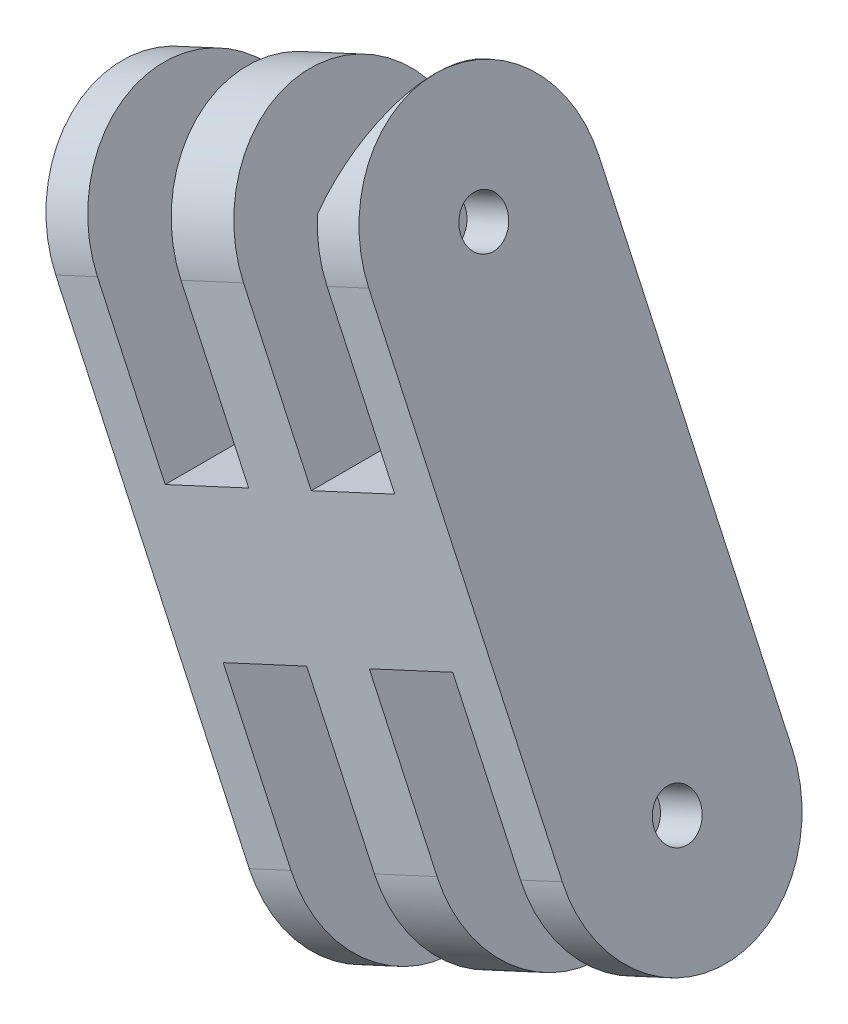
from build123d import *

# Parameters (mm, degrees)
BOSS_EXTRU_1_DEPTH      = 10
ESQUISSE2_R             = 1
ENL_V_MAT_EXTRU_1_DEPTH = 15


with BuildPart() as part:
    # Esquisse1 → Boss.-Extru.1 (new body)
    with BuildSketch(Plane.XY):
        Polygon((-110.738106784, 134.804121916), (-112.552630047, 133.962988556), (-99.935629642, 106.745139618), (-98.12110638, 107.586272978), (-103.167906542, 118.473412553), (-99.538860017, 120.155679274), (-94.492059855, 109.268539699), (-91.770274961, 110.530239739), (-96.817075123, 121.417379314), (-93.188028598, 123.099646035), (-88.141228436, 112.21250646), (-86.326705174, 113.05363982), (-98.943705578, 140.271488758), (-99.586991765, 136.903720479), (-95.711428679, 128.543215823), (-99.340475204, 126.860949102), (-104.387275366, 137.748088677), (-107.109060259, 136.486388637), (-102.062260098, 125.599249062), (-105.691306623, 123.916982341), align=None)
    extrude(amount=BOSS_EXTRU_1_DEPTH)

    # Esquisse2 → Enlèv. mat.-Extru.1 (cut)
    with BuildSketch(Plane(origin=(-27.920353757, -12.942650812, 0), x_dir=(0, 0, -1), z_dir=(0.9072616312569988, 0.42056668014583565, 0))):
        with Locations(Location((-5, 163.875365486, 0), (0, 0, 90))):
            Circle(ESQUISSE2_R)
        with Locations(Location((-5, 143.875365486, 0), (0, 0, 90))):
            Circle(ESQUISSE2_R)
        with BuildLine():
            Line((0, 138.875365486), (0, 143.875365486))
            ThreePointArc((0, 143.875365486), (-1.464466094, 140.33983158), (-5, 138.875365486))
            Line((-5, 138.875365486), (0, 138.875365486))
        make_face()
        with BuildLine():
            ThreePointArc((-5, 138.875365486), (-8.535533906, 140.33983158), (-10, 143.875365486))
            Line((-10, 143.875365486), (-10, 138.875365486))
            Line((-10, 138.875365486), (-5, 138.875365486))
        make_face()
        with BuildLine():
            Line((-10, 168.875365486), (-10, 163.875365486))
            ThreePointArc((-10, 163.875365486), (-8.535533906, 167.410899392), (-5, 168.875365486))
            Line((-5, 168.875365486), (-10, 168.875365486))
        make_face()
        with BuildLine():
            Line((0, 168.875365486), (-5, 168.875365486))
            ThreePointArc((-5, 168.875365486), (-1.464466094, 167.410899392), (0, 163.875365486))
            Line((0, 163.875365486), (0, 168.875365486))
        make_face()
    extrude(amount=-ENL_V_MAT_EXTRU_1_DEPTH, mode=Mode.SUBTRACT)


solid = part.part
